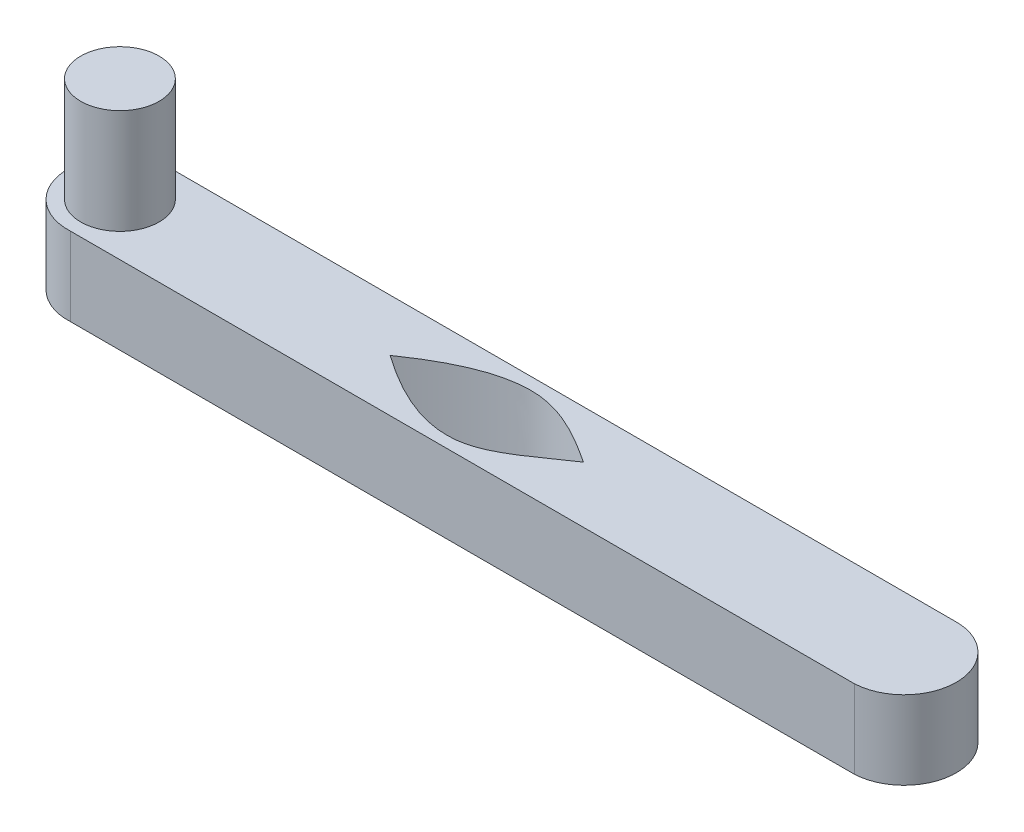
from build123d import *

# Parameters (mm, degrees)
SALIENTE_EXTRUIR1_DEPTH = 38.1
CORTAR_EXTRUIR18_DEPTH  = 38.1
CROQUIS5_R              = 19.05
SALIENTE_EXTRUIR2_DEPTH = 50.8


with BuildPart() as part:
    # Croquis1 → Saliente-Extruir1 (new body)
    with BuildSketch(Plane(origin=(0, 0, 0), x_dir=(1, 0, 0), z_dir=(0, 1, 0))):
        with BuildLine():
            Line((-61.958802083, 0), (319.041197917, 0))
            ThreePointArc((319.041197917, 0), (343.15003125, 26.627666667), (316.522364583, 50.7365))
            Line((316.522364583, 50.7365), (-64.477635417, 50.7365))
            ThreePointArc((-64.477635417, 50.7365), (-88.58646875, 24.108833333), (-61.958802083, 0))
        make_face()
    extrude(amount=SALIENTE_EXTRUIR1_DEPTH)

    # Croquis3 → Cortar-Extruir18 (cut)
    with BuildSketch(Plane(origin=(0, 38.1, 0), x_dir=(1, 0, 0), z_dir=(0, 1, 0))):
        with BuildLine():
            add(Edge.make_bspline(
                [(68.053382641, 25.36825), (85.128897701, 37.242607365), (117.715779547, 53.529246636), (147.710358419, 35.418129568), (159.94527156, 27.422727745)],
                knots=[0.293668056, 0.293668056, 0.293668056, 0.293668056, 0.509999468, 0.663692502, 0.663692502, 0.663692502, 0.663692502], degree=3))
            add(Edge.make_bspline(
                [(68.053382641, 25.36825), (85.297187869, 13.221681932), (118.362782549, -4.355831371), (146.208725565, 18.171330049), (158.923925731, 26.746070777), (159.94527156, 27.422727745)],
                knots=[0.293535528, 0.293535528, 0.293535528, 0.293535528, 0.509769313, 0.658147643, 0.671041491, 0.671041491, 0.671041491, 0.671041491], degree=3))
        make_face()
    extrude(amount=-CORTAR_EXTRUIR18_DEPTH, mode=Mode.SUBTRACT)

    # Croquis5 → Saliente-Extruir2 (add)
    with BuildSketch(Plane(origin=(0, 38.1, 0), x_dir=(1, 0, 0), z_dir=(0, 1, 0))):
        with Locations(Location((-63.21821875, 25.36825, 0), (0, 0, 270))):
            Circle(CROQUIS5_R)
    extrude(amount=SALIENTE_EXTRUIR2_DEPTH)


solid = part.part
